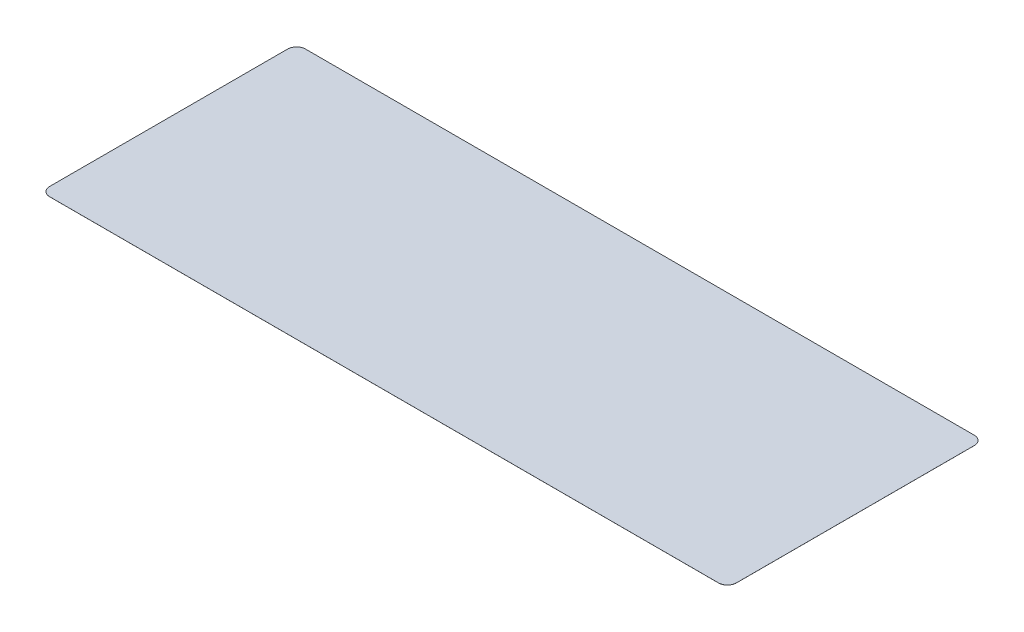
from build123d import *

# Parameters (mm, degrees)
BOSS_EXTRUDE1_DEPTH = 0.127


with BuildPart() as part:
    # Sketch1 → Boss-Extrude1 (new body)
    with BuildSketch(Plane(origin=(0, 0, 0), x_dir=(1, 0, 0), z_dir=(0, 1, 0))):
        with BuildLine():
            Line((946.15, -361.95), (-946.15, -361.95))
            ThreePointArc((-946.15, -361.95), (-964.110512242, -354.510512242), (-971.55, -336.55))
            Line((-971.55, -336.55), (-971.55, 336.55))
            ThreePointArc((-971.55, 336.55), (-964.110512242, 354.510512242), (-946.15, 361.95))
            Line((-946.15, 361.95), (946.15, 361.95))
            ThreePointArc((946.15, 361.95), (964.110512242, 354.510512242), (971.55, 336.55))
            Line((971.55, 336.55), (971.55, -336.55))
            ThreePointArc((971.55, -336.55), (964.110512242, -354.510512242), (946.15, -361.95))
        make_face()
    extrude(amount=BOSS_EXTRUDE1_DEPTH)


solid = part.part
